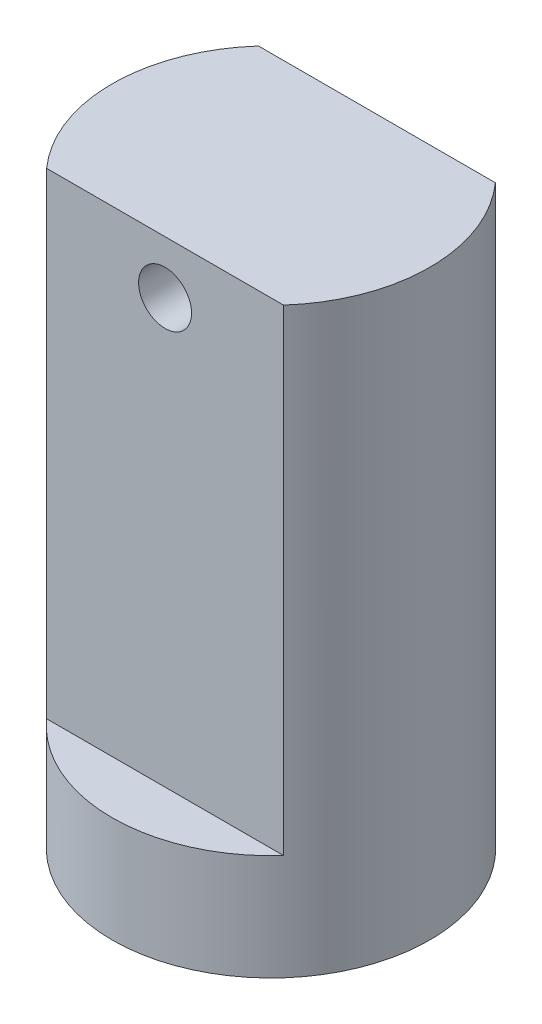
from build123d import *

# Parameters (mm, degrees)
SKETCH1_R           = 38.1
BOSS_EXTRUDE1_DEPTH = 139.7
SKETCH2_R           = 6.35
CUT_EXTRUDE1_DEPTH  = 25.4
CUT_EXTRUDE2_START  = 25.4
SKETCH3_W           = 76.2
SKETCH3_H           = 114.3
CUT_EXTRUDE2_DEPTH  = 25.4
CUT_EXTRUDE3_START  = -25.4
SKETCH3_2_W         = 76.2
SKETCH3_2_H         = 114.3
CUT_EXTRUDE3_DEPTH  = 25.4
SKETCH4_R           = 6.35
CUT_EXTRUDE4_DEPTH  = 159.113724894


with BuildPart() as part:
    # Sketch1 → Boss-Extrude1 (new body)
    with BuildSketch(Plane(origin=(0, 0, 0), x_dir=(1, 0, 0), z_dir=(0, 1, 0))):
        Circle(SKETCH1_R)
    extrude(amount=BOSS_EXTRUDE1_DEPTH)

    # Sketch2 → Cut-Extrude1 (cut)
    with BuildSketch(Plane.XZ):
        Circle(SKETCH2_R)
    extrude(amount=-CUT_EXTRUDE1_DEPTH, mode=Mode.SUBTRACT)

    # Sketch3 → Cut-Extrude2 (cut)
    with BuildSketch(Plane.XY.offset(CUT_EXTRUDE2_START)):
        with Locations((0, 82.55)):
            Rectangle(SKETCH3_W, SKETCH3_H)
    extrude(amount=CUT_EXTRUDE2_DEPTH, mode=Mode.SUBTRACT)

    # Sketch3<2> → Cut-Extrude3 (cut)
    with BuildSketch(Plane.XY.offset(CUT_EXTRUDE3_START)):
        with Locations((0, 82.55)):
            Rectangle(SKETCH3_2_W, SKETCH3_2_H)
    extrude(amount=-CUT_EXTRUDE3_DEPTH, mode=Mode.SUBTRACT)

    # Sketch4 → Cut-Extrude4 (cut, through all)
    with BuildSketch(Plane.XY.offset(25.4)):
        with Locations((0, 127)):
            Circle(SKETCH4_R)
    extrude(amount=-CUT_EXTRUDE4_DEPTH, mode=Mode.SUBTRACT)


solid = part.part
